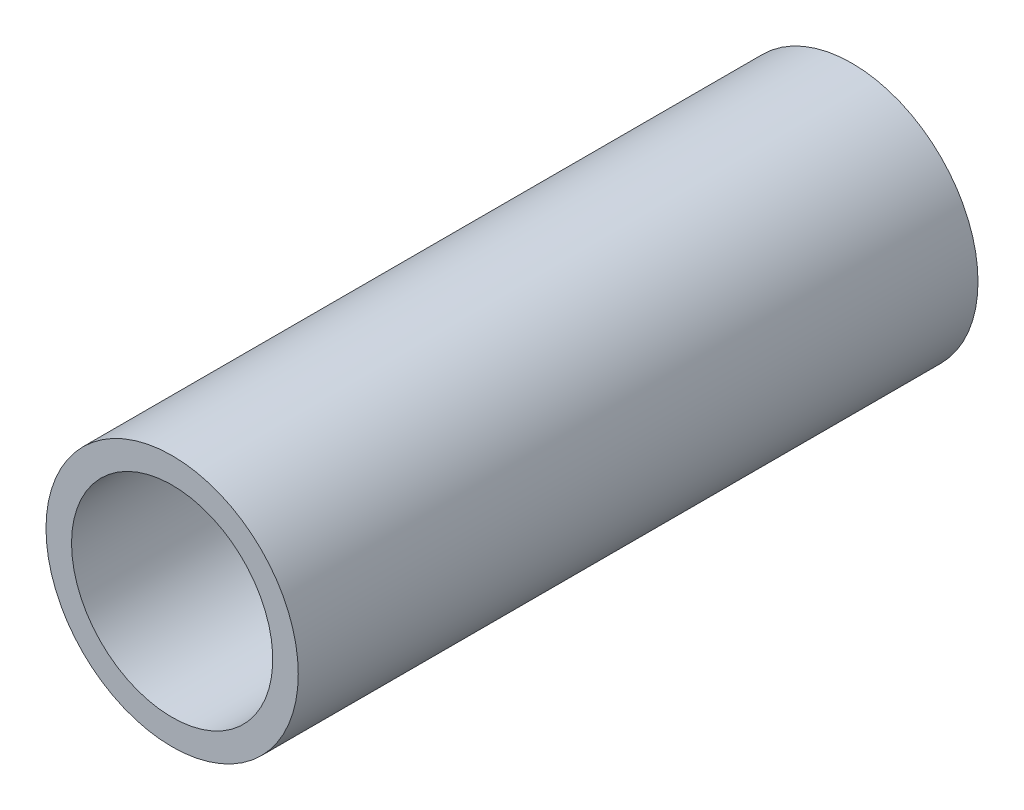
from build123d import *

# Parameters (mm, degrees)
SKETCH1_R           = 16.7005
SKETCH1_R_2         = 13.3223
EXTRUDE_THIN1_DEPTH = 45


with BuildPart() as part:
    # Sketch1 → Extrude-Thin1 (new, symmetric)
    with BuildSketch(Plane.XY):
        Circle(SKETCH1_R)
        Circle(SKETCH1_R_2, mode=Mode.SUBTRACT)
    extrude(amount=EXTRUDE_THIN1_DEPTH, both=True)


solid = part.part
